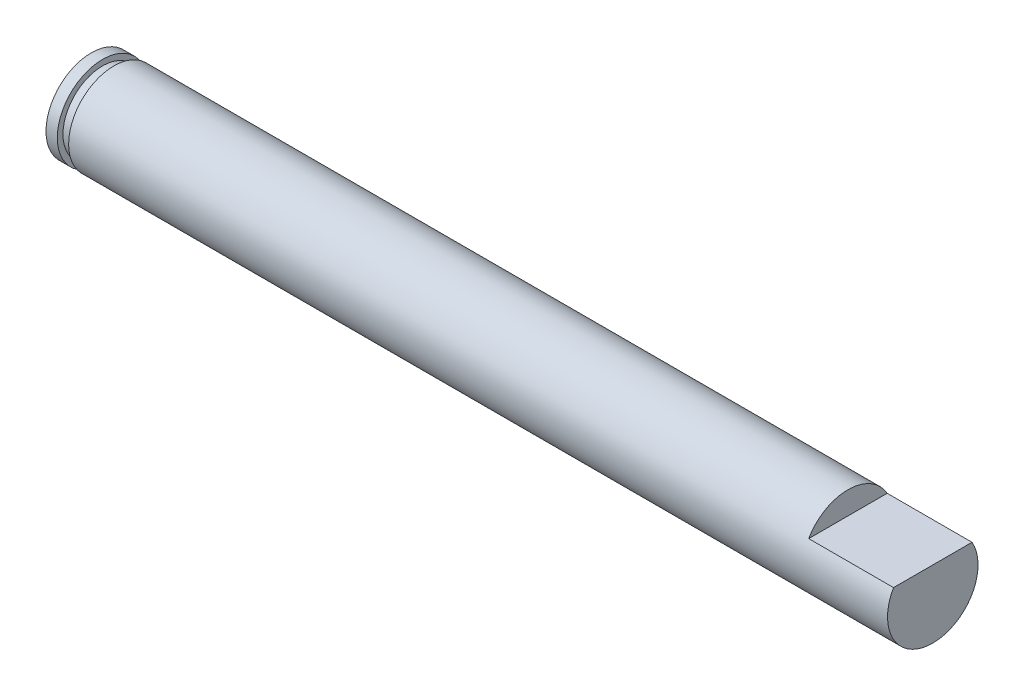
from build123d import *
from build123d.topology import SkipClean

# Parameters (mm, degrees)
SKETCH2_R           = 4
BOSS_EXTRUDE1_DEPTH = 66.9
BOSS_EXTRUDE2_DEPTH = 7.5
SKETCH4_W           = 1
SKETCH4_H           = 0.5


with BuildPart() as part:
    # Sketch2 → Boss-Extrude1 (new body)
    with BuildSketch(Plane(origin=(0, 0, 0), x_dir=(0, 0, -1), z_dir=(1, 0, 0))):
        with Locations(Location((0, 0, 0), (0, 0, 180))):
            Circle(SKETCH2_R)
    extrude(amount=BOSS_EXTRUDE1_DEPTH)

    # Sketch3 → Boss-Extrude2 (add)
    with SkipClean():  # the faces are left unmerged after this step: merging them gives an invalid solid
        with BuildSketch(Plane(origin=(66.9, 0, 0), x_dir=(0, 0, -1), z_dir=(1, 0, 0))):
            with BuildLine():
                Line((-3.469855905, 1.99), (3.469855905, 1.99))
                ThreePointArc((3.469855905, 1.99), (0, -4), (-3.469855905, 1.99))
            make_face()
        extrude(amount=BOSS_EXTRUDE2_DEPTH)

    # Sketch4 → Cut-Revolve1 (revolve, cut)
    with SkipClean():  # the faces are left unmerged after this step: merging them gives an invalid solid
        with BuildSketch(Plane.XY, mode=Mode.PRIVATE) as cut_revolve1_sk:
            with Locations((1.5, 3.75)):
                Rectangle(SKETCH4_W, SKETCH4_H)
        revolve(cut_revolve1_sk.sketch.rotate(Axis((0, 0, 0), (1, 0, 0)), 90), axis=Axis((0, 0, 0), (1, 0, 0)), mode=Mode.SUBTRACT)


solid = part.part
